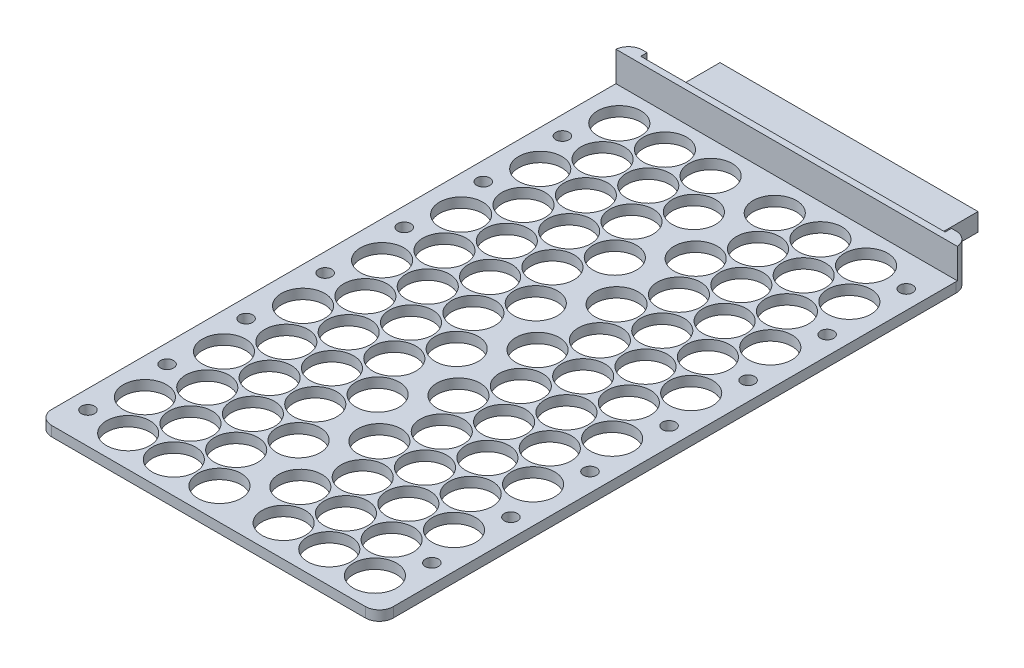
from build123d import *

# Parameters (mm, degrees)
SKETCH2_W            = 171.7
SKETCH2_H            = 290.628679219
BOSS_EXTRUDE6_DEPTH  = 5
SKETCH1_R            = 10.875
CUT_EXTRUDE1_DEPTH   = 7
SKETCH5_R            = 3.3
CUT_EXTRUDE3_DEPTH   = 5
SKETCH12_W           = 171.7
SKETCH12_H           = 20
BOSS_EXTRUDE9_DEPTH  = 6.35
SKETCH13_W           = 153.01
SKETCH13_H           = 11
CUT_EXTRUDE7_DEPTH   = 3.18
SKETCH14_W           = 129.7
SKETCH14_H           = 9
BOSS_EXTRUDE10_DEPTH = 25
FILLET1_R            = 7


with BuildPart() as part:
    # Sketch2 → Boss-Extrude6 (new body)
    with BuildSketch(Plane(origin=(0, 0, 0), x_dir=(1, 0, 0), z_dir=(0, 1, 0))):
        with Locations((85.85, 145.314339609)):
            Rectangle(SKETCH2_W, SKETCH2_H)
    extrude(amount=BOSS_EXTRUDE6_DEPTH)

    # Sketch1 → Cut-Extrude1 (cut)
    with BuildSketch(Plane(origin=(0, 0, 0), x_dir=(1, 0, 0), z_dir=(0, 1, 0))):
        with Locations(Location((130.663177129, 15.875, 0), (0, 0, 90))):
            Circle(SKETCH1_R)
        with Locations(Location((153.613177129, 15.875, 0), (0, 0, 90))):
            Circle(SKETCH1_R)
        with Locations(Location((142.138177129, 35.750283017, 0), (0, 0, 90))):
            Circle(SKETCH1_R)
        with Locations(Location((119.188177129, 35.750283017, 0), (0, 0, 90))):
            Circle(SKETCH1_R)
        with Locations(Location((96.238177129, 35.750283017, 0), (0, 0, 90))):
            Circle(SKETCH1_R)
        with Locations(Location((107.713177129, 55.625566034, 0), (0, 0, 90))):
            Circle(SKETCH1_R)
        with Locations(Location((130.663177129, 55.625566034, 0), (0, 0, 90))):
            Circle(SKETCH1_R)
        with Locations(Location((153.613177129, 55.625566034, 0), (0, 0, 90))):
            Circle(SKETCH1_R)
        with Locations(Location((142.138177129, 75.500849051, 0), (0, 0, 90))):
            Circle(SKETCH1_R)
        with Locations(Location((119.188177129, 75.500849051, 0), (0, 0, 90))):
            Circle(SKETCH1_R)
        with Locations(Location((96.238177129, 75.500849051, 0), (0, 0, 90))):
            Circle(SKETCH1_R)
        with Locations(Location((107.713177129, 95.376132067, 0), (0, 0, 90))):
            Circle(SKETCH1_R)
        with Locations(Location((130.663177129, 95.376132067, 0), (0, 0, 90))):
            Circle(SKETCH1_R)
        with Locations(Location((153.613177129, 95.376132067, 0), (0, 0, 90))):
            Circle(SKETCH1_R)
        with Locations(Location((142.138177129, 115.251415084, 0), (0, 0, 90))):
            Circle(SKETCH1_R)
        with Locations(Location((119.188177129, 115.251415084, 0), (0, 0, 90))):
            Circle(SKETCH1_R)
        with Locations(Location((96.238177129, 115.251415084, 0), (0, 0, 90))):
            Circle(SKETCH1_R)
        with Locations(Location((107.713177129, 135.126698101, 0), (0, 0, 90))):
            Circle(SKETCH1_R)
        with Locations(Location((130.663177129, 135.126698101, 0), (0, 0, 90))):
            Circle(SKETCH1_R)
        with Locations(Location((153.613177129, 135.126698101, 0), (0, 0, 90))):
            Circle(SKETCH1_R)
        with Locations(Location((142.138177129, 155.001981118, 0), (0, 0, 90))):
            Circle(SKETCH1_R)
        with Locations(Location((119.188177129, 155.001981118, 0), (0, 0, 90))):
            Circle(SKETCH1_R)
        with Locations(Location((96.238177129, 155.001981118, 0), (0, 0, 90))):
            Circle(SKETCH1_R)
        with Locations(Location((107.713177129, 174.877264135, 0), (0, 0, 90))):
            Circle(SKETCH1_R)
        with Locations(Location((96.238177129, 194.752547152, 0), (0, 0, 90))):
            Circle(SKETCH1_R)
        with Locations(Location((107.713177129, 214.627830169, 0), (0, 0, 90))):
            Circle(SKETCH1_R)
        with Locations(Location((96.238177129, 234.503113185, 0), (0, 0, 90))):
            Circle(SKETCH1_R)
        with Locations(Location((107.713177129, 254.378396202, 0), (0, 0, 90))):
            Circle(SKETCH1_R)
        with Locations(Location((96.238177129, 274.253679219, 0), (0, 0, 90))):
            Circle(SKETCH1_R)
        with Locations(Location((119.188177129, 274.253679219, 0), (0, 0, 90))):
            Circle(SKETCH1_R)
        with Locations(Location((142.138177129, 274.253679219, 0), (0, 0, 90))):
            Circle(SKETCH1_R)
        with Locations(Location((153.613177129, 254.378396202, 0), (0, 0, 90))):
            Circle(SKETCH1_R)
        with Locations(Location((130.663177129, 254.378396202, 0), (0, 0, 90))):
            Circle(SKETCH1_R)
        with Locations(Location((119.188177129, 234.503113185, 0), (0, 0, 90))):
            Circle(SKETCH1_R)
        with Locations(Location((142.138177129, 234.503113185, 0), (0, 0, 90))):
            Circle(SKETCH1_R)
        with Locations(Location((130.663177129, 214.627830169, 0), (0, 0, 90))):
            Circle(SKETCH1_R)
        with Locations(Location((153.613177129, 214.627830169, 0), (0, 0, 90))):
            Circle(SKETCH1_R)
        with Locations(Location((142.138177129, 194.752547152, 0), (0, 0, 90))):
            Circle(SKETCH1_R)
        with Locations(Location((153.613177129, 174.877264135, 0), (0, 0, 90))):
            Circle(SKETCH1_R)
        with Locations(Location((130.663177129, 174.877264135, 0), (0, 0, 90))):
            Circle(SKETCH1_R)
        with Locations(Location((119.188177129, 194.752547152, 0), (0, 0, 90))):
            Circle(SKETCH1_R)
        with Locations(Location((63.989741568, 274.253679219, 0), (0, 0, 90))):
            Circle(SKETCH1_R)
        with Locations(Location((41.039741568, 274.253679219, 0), (0, 0, 90))):
            Circle(SKETCH1_R)
        with Locations(Location((18.089741568, 274.253679219, 0), (0, 0, 90))):
            Circle(SKETCH1_R)
        with Locations(Location((29.564741568, 254.378396202, 0), (0, 0, 90))):
            Circle(SKETCH1_R)
        with Locations(Location((52.514741568, 254.378396202, 0), (0, 0, 90))):
            Circle(SKETCH1_R)
        with Locations(Location((75.464741568, 254.378396202, 0), (0, 0, 90))):
            Circle(SKETCH1_R)
        with Locations(Location((63.989741568, 234.503113185, 0), (0, 0, 90))):
            Circle(SKETCH1_R)
        with Locations(Location((41.039741568, 234.503113185, 0), (0, 0, 90))):
            Circle(SKETCH1_R)
        with Locations(Location((29.564741568, 214.627830169, 0), (0, 0, 90))):
            Circle(SKETCH1_R)
        with Locations(Location((18.089741568, 234.503113185, 0), (0, 0, 90))):
            Circle(SKETCH1_R)
        with Locations(Location((52.514741568, 214.627830169, 0), (0, 0, 90))):
            Circle(SKETCH1_R)
        with Locations(Location((75.464741568, 214.627830169, 0), (0, 0, 90))):
            Circle(SKETCH1_R)
        with Locations(Location((63.989741568, 194.752547152, 0), (0, 0, 90))):
            Circle(SKETCH1_R)
        with Locations(Location((41.039741568, 194.752547152, 0), (0, 0, 90))):
            Circle(SKETCH1_R)
        with Locations(Location((18.089741568, 194.752547152, 0), (0, 0, 90))):
            Circle(SKETCH1_R)
        with Locations(Location((75.464741568, 174.877264135, 0), (0, 0, 90))):
            Circle(SKETCH1_R)
        with Locations(Location((63.989741568, 155.001981118, 0), (0, 0, 90))):
            Circle(SKETCH1_R)
        with Locations(Location((52.514741568, 174.877264135, 0), (0, 0, 90))):
            Circle(SKETCH1_R)
        with Locations(Location((29.564741568, 174.877264135, 0), (0, 0, 90))):
            Circle(SKETCH1_R)
        with Locations(Location((41.039741568, 155.001981118, 0), (0, 0, 90))):
            Circle(SKETCH1_R)
        with Locations(Location((75.464741568, 135.126698101, 0), (0, 0, 90))):
            Circle(SKETCH1_R)
        with Locations(Location((52.514741568, 135.126698101, 0), (0, 0, 90))):
            Circle(SKETCH1_R)
        with Locations(Location((29.564741568, 135.126698101, 0), (0, 0, 90))):
            Circle(SKETCH1_R)
        with Locations(Location((18.089741568, 155.001981118, 0), (0, 0, 90))):
            Circle(SKETCH1_R)
        with Locations(Location((18.089741568, 115.251415084, 0), (0, 0, 90))):
            Circle(SKETCH1_R)
        with Locations(Location((41.039741568, 115.251415084, 0), (0, 0, 90))):
            Circle(SKETCH1_R)
        with Locations(Location((63.989741568, 115.251415084, 0), (0, 0, 90))):
            Circle(SKETCH1_R)
        with Locations(Location((75.464741568, 95.376132067, 0), (0, 0, 90))):
            Circle(SKETCH1_R)
        with Locations(Location((52.514741568, 95.376132067, 0), (0, 0, 90))):
            Circle(SKETCH1_R)
        with Locations(Location((29.564741568, 95.376132067, 0), (0, 0, 90))):
            Circle(SKETCH1_R)
        with Locations(Location((41.039741568, 75.500849051, 0), (0, 0, 90))):
            Circle(SKETCH1_R)
        with Locations(Location((18.089741568, 75.500849051, 0), (0, 0, 90))):
            Circle(SKETCH1_R)
        with Locations(Location((63.989741568, 75.500849051, 0), (0, 0, 90))):
            Circle(SKETCH1_R)
        with Locations(Location((75.464741568, 55.625566034, 0), (0, 0, 90))):
            Circle(SKETCH1_R)
        with Locations(Location((52.514741568, 55.625566034, 0), (0, 0, 90))):
            Circle(SKETCH1_R)
        with Locations(Location((29.564741568, 55.625566034, 0), (0, 0, 90))):
            Circle(SKETCH1_R)
        with Locations(Location((18.089741568, 35.750283017, 0), (0, 0, 90))):
            Circle(SKETCH1_R)
        with Locations(Location((41.039741568, 35.750283017, 0), (0, 0, 90))):
            Circle(SKETCH1_R)
        with Locations(Location((63.989741568, 35.750283017, 0), (0, 0, 90))):
            Circle(SKETCH1_R)
        with Locations(Location((75.464741568, 15.875, 0), (0, 0, 90))):
            Circle(SKETCH1_R)
        with Locations(Location((52.514741568, 15.875, 0), (0, 0, 90))):
            Circle(SKETCH1_R)
        with Locations(Location((29.564741568, 15.875, 0), (0, 0, 90))):
            Circle(SKETCH1_R)
        with Locations(Location((107.713177129, 15.875, 0), (0, 0, 90))):
            Circle(SKETCH1_R)
    extrude(amount=CUT_EXTRUDE1_DEPTH, mode=Mode.SUBTRACT)

    # Sketch5 → Cut-Extrude3 (cut)
    with BuildSketch(Plane(origin=(0, 5, 0), x_dir=(1, 0, 0), z_dir=(0, 1, 0))):
        with Locations(Location((9.344870784, 254.378396202, 0), (0, 0, 270))):
            Circle(SKETCH5_R)
        with Locations(Location((162.356588564, 35.750283017, 0), (0, 0, 270))):
            Circle(SKETCH5_R)
        with Locations(Location((162.356588564, 75.500849051, 0), (0, 0, 270))):
            Circle(SKETCH5_R)
        with Locations(Location((162.356588564, 115.251415084, 0), (0, 0, 270))):
            Circle(SKETCH5_R)
        with Locations(Location((162.356588564, 155.001981118, 0), (0, 0, 270))):
            Circle(SKETCH5_R)
        with Locations(Location((162.356588564, 194.752547152, 0), (0, 0, 270))):
            Circle(SKETCH5_R)
        with Locations(Location((162.356588564, 234.503113185, 0), (0, 0, 270))):
            Circle(SKETCH5_R)
        with Locations(Location((162.356588564, 274.253679219, 0), (0, 0, 270))):
            Circle(SKETCH5_R)
        with Locations(Location((9.344870784, 214.627830169, 0), (0, 0, 270))):
            Circle(SKETCH5_R)
        with Locations(Location((9.344870784, 174.877264135, 0), (0, 0, 270))):
            Circle(SKETCH5_R)
        with Locations(Location((9.344870784, 135.126698101, 0), (0, 0, 270))):
            Circle(SKETCH5_R)
        with Locations(Location((9.344870784, 95.376132067, 0), (0, 0, 270))):
            Circle(SKETCH5_R)
        with Locations(Location((9.344870784, 55.625566034, 0), (0, 0, 270))):
            Circle(SKETCH5_R)
        with Locations(Location((9.344870784, 15.875, 0), (0, 0, 270))):
            Circle(SKETCH5_R)
    extrude(amount=-CUT_EXTRUDE3_DEPTH, mode=Mode.SUBTRACT)

    # Sketch12 → Boss-Extrude9 (add)
    with BuildSketch(Plane(origin=(0, 0, -290.628679219), x_dir=(-1, 0, 0), z_dir=(0, 0, -1))):
        with Locations((-85.85, 10)):
            Rectangle(SKETCH12_W, SKETCH12_H)
    extrude(amount=BOSS_EXTRUDE9_DEPTH)

    # Sketch13 → Cut-Extrude7 (cut)
    with BuildSketch(Plane(origin=(0, 0, -296.978679219), x_dir=(-1, 0, 0), z_dir=(0, 0, -1))):
        with Locations((-85.85, 14.5)):
            Rectangle(SKETCH13_W, SKETCH13_H)
    extrude(amount=-CUT_EXTRUDE7_DEPTH, mode=Mode.SUBTRACT)

    # Sketch14 → Boss-Extrude10 (add)
    with BuildSketch(Plane(origin=(0, 0, -296.978679219), x_dir=(-1, 0, 0), z_dir=(0, 0, -1))):
        with Locations((-85.85, 4.5)):
            Rectangle(SKETCH14_W, SKETCH14_H)
    extrude(amount=BOSS_EXTRUDE10_DEPTH)

    # Fillet1
    fillet1_edges = [part.edges().sort_by_distance(p)[0] for p in [
        (171.7, 10, -296.978679219),
        (0, 10, -296.978679219),
        (171.7, 2.5, 0),
        (0, 2.5, 0),
    ]]
    fillet(fillet1_edges, radius=FILLET1_R)


solid = part.part
